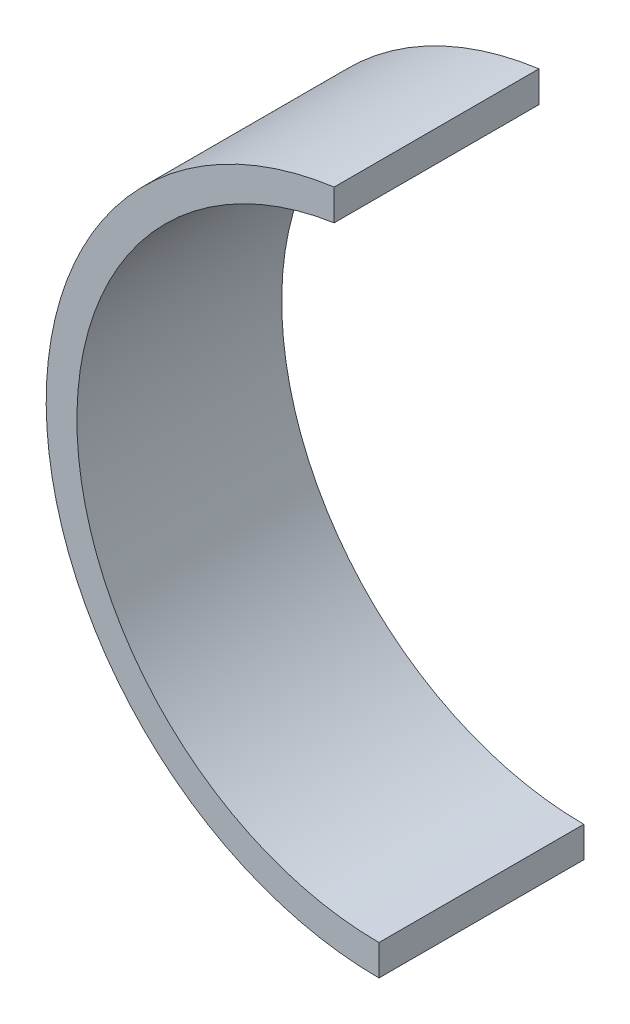
from build123d import *

# Parameters (mm, degrees)
BOSS_EXTRUDE1_DEPTH = 20


with BuildPart() as part:
    # Sketch1 → Boss-Extrude1 (new body)
    with BuildSketch(Plane.XY):
        with BuildLine():
            Line((0, -29.5), (0, -32.5))
            ThreePointArc((0, -32.5), (-32.4258356, -2.194353132), (-4.378691316, 32.203680882))
            Line((-4.378691316, 32.203680882), (-4.378691316, 29.173225093))
            ThreePointArc((-4.378691316, 29.173225093), (-29.418192843, -2.195433869), (0, -29.5))
        make_face()
    extrude(amount=BOSS_EXTRUDE1_DEPTH)


solid = part.part
